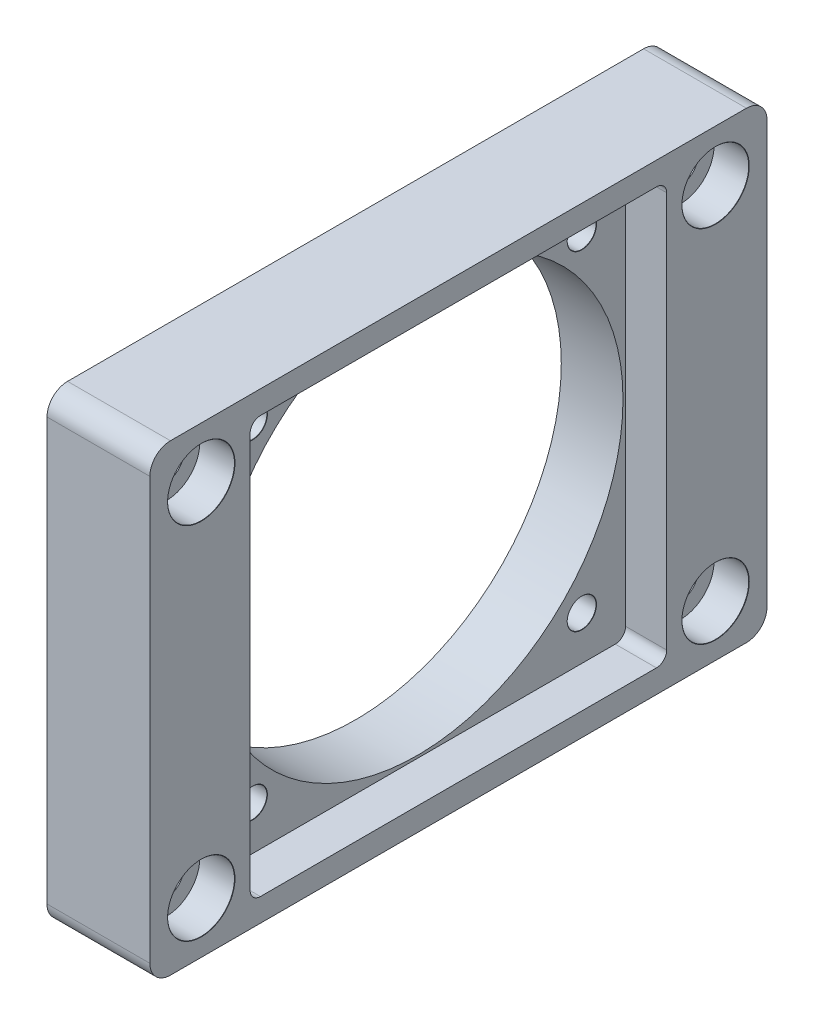
from build123d import *

# Parameters (mm, degrees)
SKETCH1_W                                    = 60
SKETCH1_H                                    = 45
BOSS_EXTRUDE1_DEPTH                          = 10
SKETCH2_W                                    = 40.5
SKETCH2_H                                    = 40.5
CUT_EXTRUDE1_DEPTH                           = 4
SKETCH3_R                                    = 20
CUT_EXTRUDE2_DEPTH                           = 10
FILLET1_R                                    = 1
F_2_8_2_8_DIAMETER_HOLE1_D                   = 2.8
F_2_8_2_8_DIAMETER_HOLE1_CSINK_D             = 2.85
F_2_8_2_8_DIAMETER_HOLE1_CSINK_ANGLE         = 90
CBORE_FOR_M3_HEX_SOCKET_HEAD_CAP_SCR_2_COUNT = 2
CBORE_FOR_M3_HEX_SOCKET_HEAD_CAP_SCR_2_PITCH = 30.516389039
CBORE_FOR_M3_HEX_SOCKET_HEAD_CAP_SCR_3_COUNT = 2
CBORE_FOR_M3_HEX_SOCKET_HEAD_CAP_SCR_3_PITCH = 61.032778079
CBORE_FOR_M3_HEX_SOCKET_HEAD_CAP_SCR_4_COUNT = 2
CBORE_FOR_M3_HEX_SOCKET_HEAD_CAP_SCR_4_PITCH = 50
CBORE_FOR_M3_HEX_SOCKET_HEAD_CAP_SCR_5_COUNT = 2
CBORE_FOR_M3_HEX_SOCKET_HEAD_CAP_SCR_5_PITCH = 35
FILLET3_R                                    = 2


with BuildPart() as part:
    # Sketch1 → Boss-Extrude1 (new body)
    with BuildSketch(Plane(origin=(0, 0, 0), x_dir=(0, 0, -1), z_dir=(1, 0, 0))):
        Rectangle(SKETCH1_W, SKETCH1_H)
    extrude(amount=BOSS_EXTRUDE1_DEPTH)

    # Sketch2 → Cut-Extrude1 (cut)
    with BuildSketch(Plane(origin=(10, 0, 0), x_dir=(0, 0, -1), z_dir=(1, 0, 0))):
        Rectangle(SKETCH2_W, SKETCH2_H)
    extrude(amount=-CUT_EXTRUDE1_DEPTH, mode=Mode.SUBTRACT)

    # Sketch3 → Cut-Extrude2 (cut)
    with BuildSketch(Plane(origin=(6, 0, 0), x_dir=(0, 0, -1), z_dir=(1, 0, 0))):
        Circle(SKETCH3_R)
    extrude(amount=-CUT_EXTRUDE2_DEPTH, mode=Mode.SUBTRACT)

    # Fillet1
    fillet1_edges = [part.edges().sort_by_distance(p)[0] for p in [
        (8, 20.25, -20.25),
        (8, -20.25, -20.25),
        (8, -20.25, 20.25),
        (8, 20.25, 20.25),
    ]]
    fillet(fillet1_edges, radius=FILLET1_R)

    # Ø2.8 (2.8) Diameter Hole1 (through all)
    with Locations(Plane(origin=(6, 0, 0), x_dir=(0, 0, -1), z_dir=(1, 0, 0))):
        with Locations((0, 0), (16, -16), (-16, 16), (-16, -16), (16, 16)):
            CounterSinkHole(F_2_8_2_8_DIAMETER_HOLE1_D / 2, F_2_8_2_8_DIAMETER_HOLE1_CSINK_D / 2, counter_sink_angle=F_2_8_2_8_DIAMETER_HOLE1_CSINK_ANGLE)

    # Sketch14 → CBORE for M3 Hex Socket Head Cap Screw2 (revolve, cut)
    with BuildSketch(Plane(origin=(10, -17.5, -25), x_dir=(0, 0, -1), z_dir=(0, 1, 0))):
        Polygon((0, 0), (0, 10), (1.7, 10), (1.7, 3.4), (3.25, 3.4), (3.25, 0.025), (3.275, 0), align=None)
    cbore_for_m3_hex_socket_head_cap_screw2 = revolve(axis=Axis((16.35, -17.5, -25), (-1, 0, 0)), mode=Mode.SUBTRACT)

    # CBORE for M3 Hex Socket Head Cap Scr 2: CBORE for M3 Hex Socket Head Cap Screw2 ×2
    with Locations(*[Vector(0, 0.5734623443633283, 0.8192319205190406) * (i * CBORE_FOR_M3_HEX_SOCKET_HEAD_CAP_SCR_2_PITCH) for i in range(1, CBORE_FOR_M3_HEX_SOCKET_HEAD_CAP_SCR_2_COUNT)]):
        add(cbore_for_m3_hex_socket_head_cap_screw2, mode=Mode.SUBTRACT)

    # CBORE for M3 Hex Socket Head Cap Scr 3: CBORE for M3 Hex Socket Head Cap Screw2 ×2
    with Locations(*[Vector(0, 0.5734623443633283, 0.8192319205190406) * (i * CBORE_FOR_M3_HEX_SOCKET_HEAD_CAP_SCR_3_PITCH) for i in range(1, CBORE_FOR_M3_HEX_SOCKET_HEAD_CAP_SCR_3_COUNT)]):
        add(cbore_for_m3_hex_socket_head_cap_screw2, mode=Mode.SUBTRACT)

    # CBORE for M3 Hex Socket Head Cap Scr 4: CBORE for M3 Hex Socket Head Cap Screw2 ×2
    with Locations(*[(0, 0, i * CBORE_FOR_M3_HEX_SOCKET_HEAD_CAP_SCR_4_PITCH) for i in range(1, CBORE_FOR_M3_HEX_SOCKET_HEAD_CAP_SCR_4_COUNT)]):
        add(cbore_for_m3_hex_socket_head_cap_screw2, mode=Mode.SUBTRACT)

    # CBORE for M3 Hex Socket Head Cap Scr 5: CBORE for M3 Hex Socket Head Cap Screw2 ×2
    with Locations(*[(0, i * CBORE_FOR_M3_HEX_SOCKET_HEAD_CAP_SCR_5_PITCH, 0) for i in range(1, CBORE_FOR_M3_HEX_SOCKET_HEAD_CAP_SCR_5_COUNT)]):
        add(cbore_for_m3_hex_socket_head_cap_screw2, mode=Mode.SUBTRACT)

    # Fillet3
    fillet3_edges = [part.edges().sort_by_distance(p)[0] for p in [
        (5, -22.5, -30),
        (5, -22.5, 30),
        (5, 22.5, 30),
        (5, 22.5, -30),
    ]]
    fillet(fillet3_edges, radius=FILLET3_R)


solid = part.part
